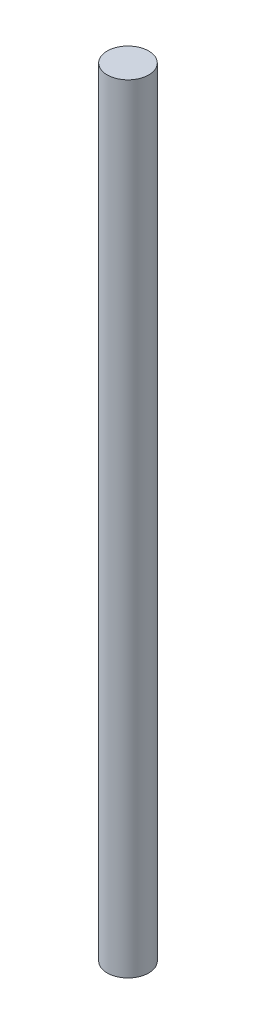
from build123d import *

# Parameters (mm, degrees)
CROQUIS1_R              = 4
SALIENTE_EXTRUIR1_DEPTH = 150


with BuildPart() as part:
    # Croquis1 → Saliente-Extruir1 (new body)
    with BuildSketch(Plane(origin=(0, 0, 0), x_dir=(1, 0, 0), z_dir=(0, 1, 0))):
        with Locations(Location((0, 0, 0), (0, 0, 270))):
            Circle(CROQUIS1_R)
    extrude(amount=SALIENTE_EXTRUIR1_DEPTH)


solid = part.part
